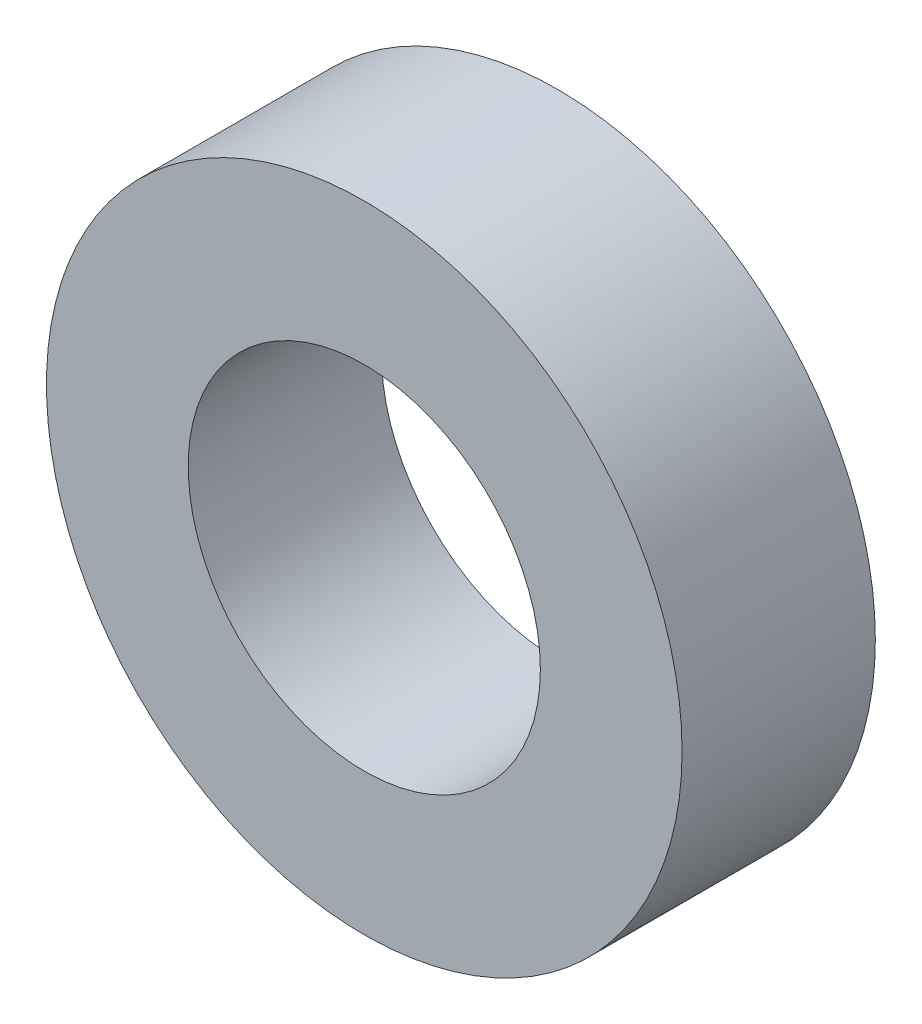
from build123d import *

# Parameters (mm, degrees)
SCHIZZO1_R                   = 7.4
SCHIZZO1_R_2                 = 4.1
ESTRUSIONE_ESTRUSIONE1_DEPTH = 4.5


with BuildPart() as part:
    # Schizzo1 → Estrusione-Estrusione1 (new body)
    with BuildSketch(Plane.XY):
        Circle(SCHIZZO1_R)
        Circle(SCHIZZO1_R_2, mode=Mode.SUBTRACT)
    extrude(amount=ESTRUSIONE_ESTRUSIONE1_DEPTH)


solid = part.part
